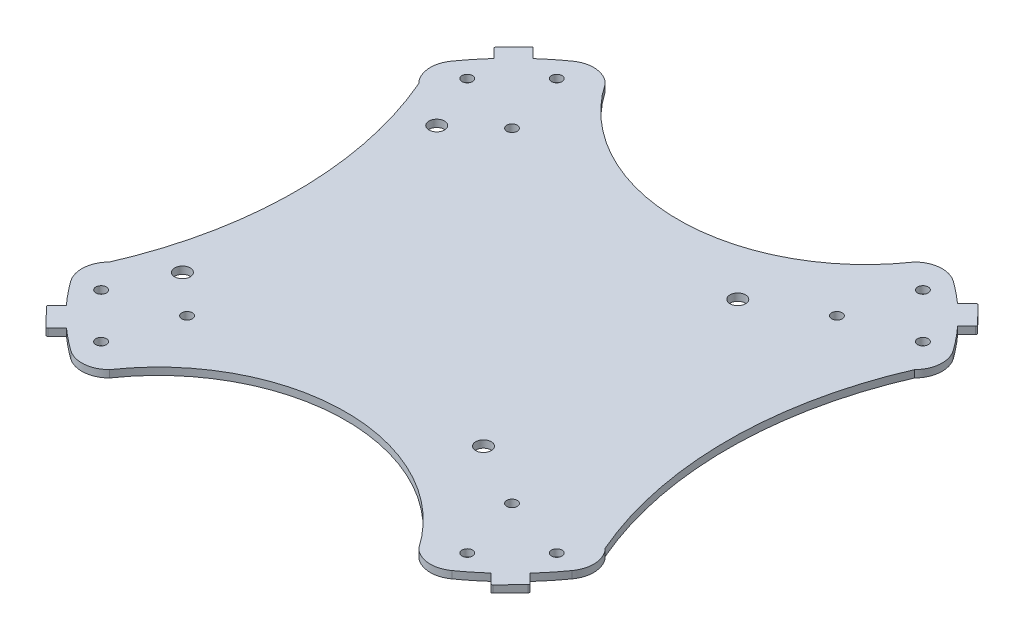
from build123d import *

# Parameters (mm, degrees)
SKETCH1_R           = 1.015999988
SKETCH1_R_2         = 1.5
BOSS_EXTRUDE1_DEPTH = 1.397


with BuildPart() as part:
    # Sketch1 → Boss-Extrude1 (new body)
    with BuildSketch(Plane(origin=(0, 0, 0), x_dir=(1, 0, 0), z_dir=(0, 1, 0))):
        with BuildLine():
            Line((-44.657487237, -41.209177315), (-46.396043568, -42.947733628))
            ThreePointArc((-46.396043568, -42.947733628), (-46.470434263, -43.125880965), (-46.398093324, -43.304870455))
            Line((-46.398093324, -43.304870455), (-43.050556795, -46.730153534))
            ThreePointArc((-43.050556795, -46.730153534), (-42.865374809, -46.831022569), (-42.667823867, -46.757262447))
            Line((-42.667823867, -46.757262447), (-40.871772634, -44.961211232))
            ThreePointArc((-40.871772634, -44.961211232), (-38.831009245, -46.687575098), (-36.702263685, -48.30420423))
            ThreePointArc((-36.702263685, -48.30420423), (-33.138347002, -49.294565873), (-29.78114627, -47.741658512))
            ThreePointArc((-29.78114627, -47.741658512), (0, -32.054645119), (29.78114627, -47.741658512))
            ThreePointArc((29.78114627, -47.741658512), (33.138347002, -49.294565873), (36.702263685, -48.30420423))
            ThreePointArc((36.702263685, -48.30420423), (38.831009245, -46.687575098), (40.871772634, -44.961211232))
            Line((40.871772634, -44.961211232), (42.667823867, -46.757262447))
            ThreePointArc((42.667823867, -46.757262447), (42.865374809, -46.831022569), (43.050556795, -46.730153534))
            Line((43.050556795, -46.730153534), (46.398093324, -43.304870455))
            ThreePointArc((46.398093324, -43.304870455), (46.470434263, -43.125880965), (46.396043568, -42.947733628))
            Line((46.396043568, -42.947733628), (44.657487237, -41.209177315))
            ThreePointArc((44.657487237, -41.209177315), (46.545191357, -39.007785017), (48.30420423, -36.702263685))
            ThreePointArc((48.30420423, -36.702263685), (49.294565905, -33.13834702), (47.741658512, -29.78114627))
            ThreePointArc((47.741658512, -29.78114627), (41.575395348, 0), (47.741658512, 29.78114627))
            ThreePointArc((47.741658512, 29.78114627), (49.294565905, 33.13834702), (48.30420423, 36.702263685))
            ThreePointArc((48.30420423, 36.702263685), (46.545191357, 39.007785017), (44.657487237, 41.209177315))
            Line((44.657487237, 41.209177315), (46.396043568, 42.947733628))
            ThreePointArc((46.396043568, 42.947733628), (46.470434263, 43.125880965), (46.398093324, 43.304870455))
            Line((46.398093324, 43.304870455), (43.050556795, 46.730153534))
            ThreePointArc((43.050556795, 46.730153534), (42.865374809, 46.831022569), (42.667823867, 46.757262447))
            Line((42.667823867, 46.757262447), (40.871772634, 44.961211232))
            ThreePointArc((40.871772634, 44.961211232), (38.831009245, 46.687575098), (36.702263685, 48.30420423))
            ThreePointArc((36.702263685, 48.30420423), (33.138347002, 49.294565873), (29.78114627, 47.741658512))
            ThreePointArc((29.78114627, 47.741658512), (0, 32.054645119), (-29.78114627, 47.741658512))
            ThreePointArc((-29.78114627, 47.741658512), (-33.138347002, 49.294565873), (-36.702263685, 48.30420423))
            ThreePointArc((-36.702263685, 48.30420423), (-38.831009245, 46.687575098), (-40.871772634, 44.961211232))
            Line((-40.871772634, 44.961211232), (-42.667823867, 46.757262447))
            ThreePointArc((-42.667823867, 46.757262447), (-42.865374809, 46.831022569), (-43.050556795, 46.730153534))
            Line((-43.050556795, 46.730153534), (-46.398093324, 43.304870455))
            ThreePointArc((-46.398093324, 43.304870455), (-46.470434263, 43.125880965), (-46.396043568, 42.947733628))
            Line((-46.396043568, 42.947733628), (-44.657487237, 41.209177315))
            ThreePointArc((-44.657487237, 41.209177315), (-46.545191357, 39.007785017), (-48.30420423, 36.702263685))
            ThreePointArc((-48.30420423, 36.702263685), (-49.294565905, 33.13834702), (-47.741658512, 29.78114627))
            ThreePointArc((-47.741658512, 29.78114627), (-41.575395348, 0), (-47.741658512, -29.78114627))
            ThreePointArc((-47.741658512, -29.78114627), (-49.294565905, -33.13834702), (-48.30420423, -36.702263685))
            ThreePointArc((-48.30420423, -36.702263685), (-46.545191357, -39.007785017), (-44.657487237, -41.209177315))
        make_face()
        with Locations(Location((-35.273880272, -43.89492624, 0), (0, 0, 90))):
            Circle(SKETCH1_R, mode=Mode.SUBTRACT)
        with Locations(Location((-43.894926149, -35.273880364, 0), (0, 0, 270))):
            Circle(SKETCH1_R, mode=Mode.SUBTRACT)
        with Locations(Location((-31.299173944, -31.299174035, 0), (0, 0, 270))):
            Circle(SKETCH1_R, mode=Mode.SUBTRACT)
        with Locations(Location((43.894926149, -35.273880364, 0), (0, 0, 90))):
            Circle(SKETCH1_R, mode=Mode.SUBTRACT)
        with Locations(Location((35.273880272, -43.89492624, 0), (0, 0, 270))):
            Circle(SKETCH1_R, mode=Mode.SUBTRACT)
        with Locations(Location((31.299173944, -31.299174035, 0), (0, 0, 90))):
            Circle(SKETCH1_R, mode=Mode.SUBTRACT)
        with Locations(Location((-35.273880272, 43.89492624, 0), (0, 0, 270))):
            Circle(SKETCH1_R, mode=Mode.SUBTRACT)
        with Locations(Location((-31.299173944, 31.299174035, 0), (0, 0, 90))):
            Circle(SKETCH1_R, mode=Mode.SUBTRACT)
        with Locations(Location((-43.894926149, 35.273880364, 0), (0, 0, 90))):
            Circle(SKETCH1_R, mode=Mode.SUBTRACT)
        with Locations(Location((43.894926149, 35.273880364, 0), (0, 0, 270))):
            Circle(SKETCH1_R, mode=Mode.SUBTRACT)
        with Locations(Location((35.273880272, 43.89492624, 0), (0, 0, 90))):
            Circle(SKETCH1_R, mode=Mode.SUBTRACT)
        with Locations(Location((31.299173944, 31.299174035, 0), (0, 0, 270))):
            Circle(SKETCH1_R, mode=Mode.SUBTRACT)
        with Locations(Location((-39, 24.5, 0), (0, 0, 270))):
            Circle(SKETCH1_R_2, mode=Mode.SUBTRACT)
        with Locations(Location((19, 24.5, 0), (0, 0, 270))):
            Circle(SKETCH1_R_2, mode=Mode.SUBTRACT)
        with Locations(Location((19.002972949, -24.499403884, 0), (0, 0, 270))):
            Circle(SKETCH1_R_2, mode=Mode.SUBTRACT)
        with Locations(Location((-39, -24.5, 0), (0, 0, 270))):
            Circle(SKETCH1_R_2, mode=Mode.SUBTRACT)
    extrude(amount=BOSS_EXTRUDE1_DEPTH)


solid = part.part
